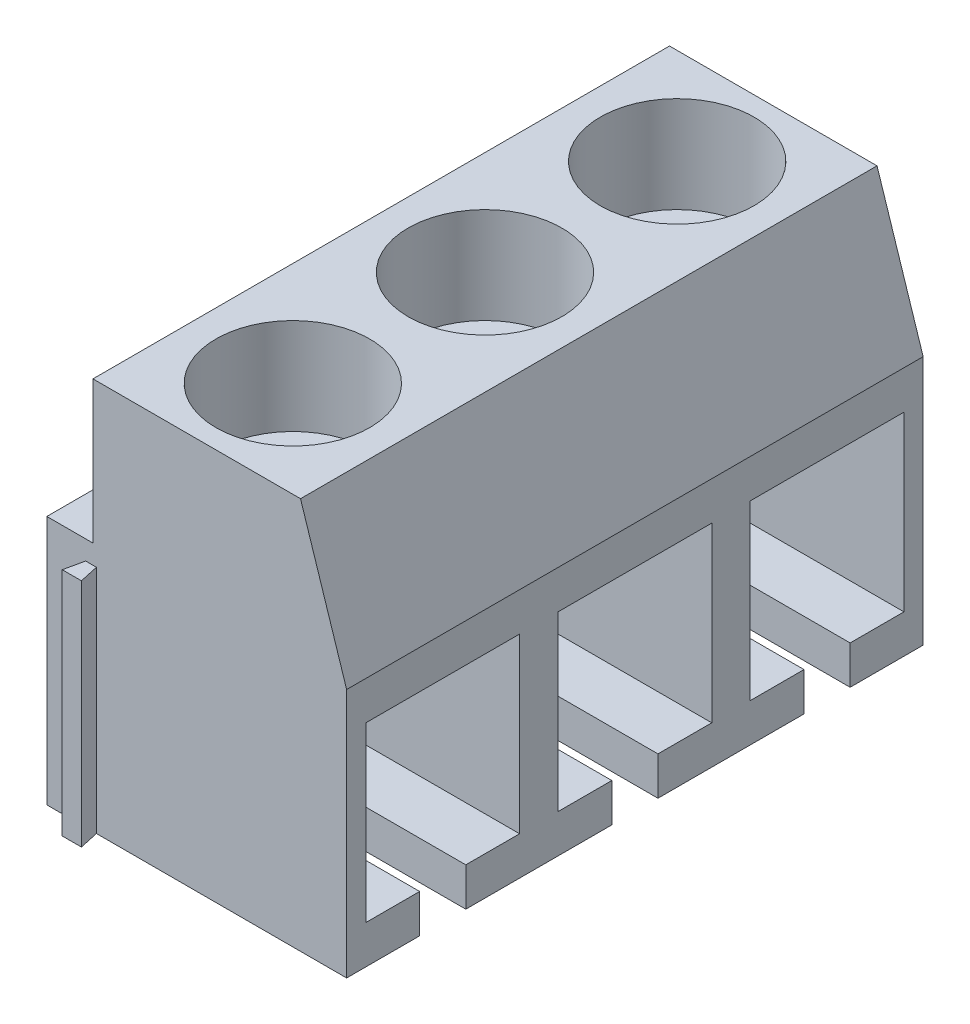
from build123d import *

# Parameters (mm, degrees)
BOSS_EXTRUDE1_DEPTH = 15
SKETCH3_R           = 2
CUT_EXTRUDE2_DEPTH  = 2.5
SKETCH4_R           = 1
CUT_EXTRUDE3_DEPTH  = 3
SKETCH2_W           = 4
SKETCH2_H           = 4.5
CUT_EXTRUDE1_DEPTH  = 6
SKETCH5_W           = 1.2
SKETCH5_H           = 2
CUT_EXTRUDE4_DEPTH  = 5.2
SKETCH6_W           = 0.5
SKETCH6_H           = 6
BOSS_EXTRUDE2_DEPTH = 0.5
SKETCH7_W           = 0.5
SKETCH7_H           = 6
CUT_EXTRUDE5_DEPTH  = 0.5
LPATTERN1_COUNT     = 3
LPATTERN1_PITCH     = 5
CUT_EXTRUDE6_DEPTH  = 10
BOSS_EXTRUDE3_DEPTH = 6


with BuildPart() as part:
    # Sketch1 → Boss-Extrude1 (new body)
    with BuildSketch(Plane.XY):
        Polygon((2.7, 5.1), (-2.7, 5.1), (-2.7, 1.4), (-3.9, 1.4), (-3.9, -5.1), (3.9, -5.1), (3.9, 1.4), align=None)
    extrude(amount=-BOSS_EXTRUDE1_DEPTH)

    # Sketch3 → Cut-Extrude2 (cut)
    with BuildSketch(Plane(origin=(0, 5.1, 0), x_dir=(1, 0, 0), z_dir=(0, 1, 0))):
        with Locations(Location((0, 2.5, 0), (0, 0, 270))):
            Circle(SKETCH3_R)
        with Locations(Location((0, 7.5, 0), (0, 0, 270))):
            Circle(SKETCH3_R)
        with Locations(Location((0, 12.5, 0), (0, 0, 270))):
            Circle(SKETCH3_R)
    extrude(amount=-CUT_EXTRUDE2_DEPTH, mode=Mode.SUBTRACT)

    # Sketch4 → Cut-Extrude3 (cut)
    with BuildSketch(Plane(origin=(0, 2.6, 0), x_dir=(1, 0, 0), z_dir=(0, 1, 0))):
        with Locations(Location((0, 2.5, 0), (0, 0, 270))):
            Circle(SKETCH4_R)
        with Locations(Location((0, 7.5, 0), (0, 0, 270))):
            Circle(SKETCH4_R)
        with Locations(Location((0, 12.5, 0), (0, 0, 270))):
            Circle(SKETCH4_R)
    extrude(amount=-CUT_EXTRUDE3_DEPTH, mode=Mode.SUBTRACT)

    # Sketch2 → Cut-Extrude1 (cut)
    with BuildSketch(Plane(origin=(3.9, 0, 0), x_dir=(0, 0, -1), z_dir=(1, 0, 0))):
        with Locations((2.5, -1.85)):
            Rectangle(SKETCH2_W, SKETCH2_H)
    cut_extrude1 = extrude(amount=-CUT_EXTRUDE1_DEPTH, mode=Mode.SUBTRACT)

    # Sketch5 → Cut-Extrude4 (cut)
    with BuildSketch(Plane(origin=(3.9, 0, 0), x_dir=(0, 0, -1), z_dir=(1, 0, 0))):
        with Locations((2.5, -5.1)):
            Rectangle(SKETCH5_W, SKETCH5_H)
    cut_extrude4 = extrude(amount=-CUT_EXTRUDE4_DEPTH, mode=Mode.SUBTRACT)

    # Sketch6 → Boss-Extrude2 (add)
    with BuildSketch(Plane.XY):
        with Locations((-2.75, -2.1)):
            Rectangle(SKETCH6_W, SKETCH6_H)
    extrude(amount=BOSS_EXTRUDE2_DEPTH)

    # Sketch7 → Cut-Extrude5 (cut)
    with BuildSketch(Plane(origin=(0, 0, -15), x_dir=(-1, 0, 0), z_dir=(0, 0, -1))):
        with Locations((2.75, -2.1)):
            Rectangle(SKETCH7_W, SKETCH7_H)
    extrude(amount=-CUT_EXTRUDE5_DEPTH, mode=Mode.SUBTRACT)

    # LPattern1: Cut-Extrude1, Cut-Extrude4 ×3
    with Locations(*[(0, 0, -i * LPATTERN1_PITCH) for i in range(1, LPATTERN1_COUNT)]):
        add(cut_extrude1, mode=Mode.SUBTRACT)
        add(cut_extrude4, mode=Mode.SUBTRACT)

    # Sketch8 → Cut-Extrude6 (cut)
    with BuildSketch(Plane(origin=(0, 0.9, 0), x_dir=(1, 0, 0), z_dir=(0, 1, 0))):
        Polygon((-3, -0.5), (-2.89, 0), (-3, 0), align=None)
        Polygon((-2.5, -0.5), (-2.61, 0), (-2.5, 0), align=None)
    extrude(amount=-CUT_EXTRUDE6_DEPTH, mode=Mode.SUBTRACT)

    # Sketch9 → Boss-Extrude3 (add)
    with BuildSketch(Plane.XZ.offset(5.1)):
        Polygon((-3, -14.5), (-2.89, -15), (-3, -15), align=None)
        Polygon((-2.5, -14.5), (-2.61, -15), (-2.5, -15), align=None)
    extrude(amount=-BOSS_EXTRUDE3_DEPTH)


solid = part.part
